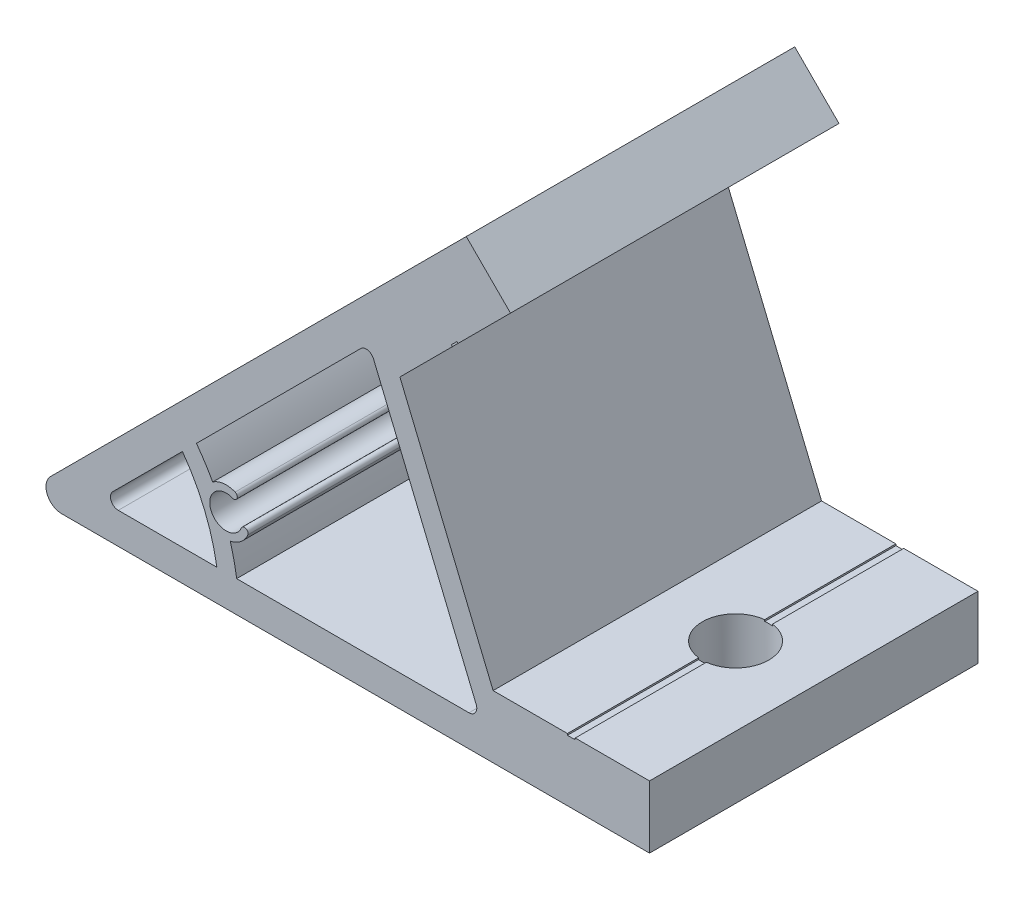
from build123d import *

# Parameters (mm, degrees)
EXTRUDE_1_DEPTH     = 42
FILLET_1_R          = 2
FILLET_2_R          = 1
FILLET_3_R          = 1
CUT_EXTRUDE_1_REACH = 89.88
SKETCH_2_R          = 4.25
CUT_EXTRUDE_2_REACH = 94.906
SKETCH_3_R          = 4.25
SKETCH_4_W          = 42
SKETCH_4_H          = 1
CUT_EXTRUDE_3_DEPTH = 0.2
SKETCH_5_W          = 1
SKETCH_5_H          = 42
CUT_EXTRUDE_4_DEPTH = 0.2


with BuildPart() as part:
    # 草图1 → 凸台-拉伸1 (new body)
    with BuildSketch(Plane.XY):
        Polygon((0, 0), (60, 0), (60, 8), (40, 8), (28.083261121, 36.769552622), (42.225396744, 50.911688245), (36.568542495, 56.568542495), (-20, 0), align=None)
        with BuildLine():
            Line((24.130306277, 38.473452028), (2.067060132, 16.410205883))
            ThreePointArc((2.067060132, 16.410205883), (3.161356319, 14.825706508), (4.142085372, 13.168512212))
            ThreePointArc((4.142085372, 13.168512212), (5.535917687, 13.696629788), (7.01188026, 13.488756805))
            ThreePointArc((7.01188026, 13.488756805), (7.256435362, 12.901225698), (6.668904255, 12.656670595))
            ThreePointArc((6.668904255, 12.656670595), (3.928479892, 9.911500898), (7.80738065, 9.90814544))
            ThreePointArc((7.80738065, 9.90814544), (8.395754452, 10.150666099), (8.638275111, 9.562292298))
            ThreePointArc((8.638275111, 9.562292298), (7.741600362, 8.371640758), (6.382576562, 7.759487995))
            ThreePointArc((6.382576562, 7.759487995), (6.860909722, 5.894194507), (7.207535721, 4))
            Line((7.207535721, 4), (38.409677649, 4))
            Line((38.409677649, 4), (24.130306277, 38.473452028))
        make_face(mode=Mode.SUBTRACT)
        with BuildLine():
            Line((-10.343145751, 4), (4.677925359, 4))
            ThreePointArc((4.677925359, 4), (3.096988313, 9.567085809), (0.278355491, 14.621501242))
            Line((0.278355491, 14.621501242), (-10.343145751, 4))
        make_face(mode=Mode.SUBTRACT)
    extrude(amount=EXTRUDE_1_DEPTH)

    # 圆角1
    fillet_1_edges = [part.edges().sort_by_distance(p)[0] for p in [
        (-20, 0, 21),
    ]]
    fillet(fillet_1_edges, radius=FILLET_1_R)

    # 圆角2
    fillet_2_edges = [part.edges().sort_by_distance(p)[0] for p in [
        (-10.343145751, 4, 21),
    ]]
    fillet(fillet_2_edges, radius=FILLET_2_R)

    # 圆角3
    fillet_3_edges = [part.edges().sort_by_distance(p)[0] for p in [
        (38.409677649, 4, 21),
        (24.130306277, 38.473452028, 21),
    ]]
    fillet(fillet_3_edges, radius=FILLET_3_R)

    # 草图2 → 切除-拉伸1 (cut, up to next)
    with BuildSketch(Plane(origin=(0, 8, 0), x_dir=(1, 0, 0), z_dir=(0, 1, 0)), mode=Mode.PRIVATE) as cut_extrude_1_sk1:
        with Locations(Location((50, -21, 0), (0, 0, 270))):
            Circle(SKETCH_2_R)
    cut_extrude_1_tool1 = extrude(cut_extrude_1_sk1.sketch, amount=-CUT_EXTRUDE_1_REACH, mode=Mode.PRIVATE) & part.part
    add(cut_extrude_1_tool1.solids().sort_by_distance((50, 8, 21))[0], mode=Mode.SUBTRACT)

    # 草图3 → 切除-拉伸2 (cut, up to next)
    with BuildSketch(Plane(origin=(-4.343145751, 4.343145751, 0), x_dir=(0, 0, -1), z_dir=(0.7071067811865441, -0.7071067811865509, 0)), mode=Mode.PRIVATE) as cut_extrude_2_sk1:
        with Locations(Location((-21, 55.857864376, 0), (0, 0, 90))):
            Circle(SKETCH_3_R)
    cut_extrude_2_tool1 = extrude(cut_extrude_2_sk1.sketch, amount=-CUT_EXTRUDE_2_REACH, mode=Mode.PRIVATE) & part.part
    add(cut_extrude_2_tool1.solids().sort_by_distance((35.154329, 43.84062, 21))[0], mode=Mode.SUBTRACT)

    # 草图4 → 切除-拉伸3 (cut)
    with BuildSketch(Plane(origin=(-4.343145751, 4.343145751, 0), x_dir=(0, 0, -1), z_dir=(0.7071067811865441, -0.7071067811865509, 0))):
        with Locations((-21, 55.857864376)):
            Rectangle(SKETCH_4_W, SKETCH_4_H)
    extrude(amount=-CUT_EXTRUDE_3_DEPTH, mode=Mode.SUBTRACT)

    # 草图5 → 切除-拉伸4 (cut)
    with BuildSketch(Plane(origin=(0, 8, 0), x_dir=(1, 0, 0), z_dir=(0, 1, 0))):
        with Locations((50, -21)):
            Rectangle(SKETCH_5_W, SKETCH_5_H)
    extrude(amount=-CUT_EXTRUDE_4_DEPTH, mode=Mode.SUBTRACT)


solid = part.part
